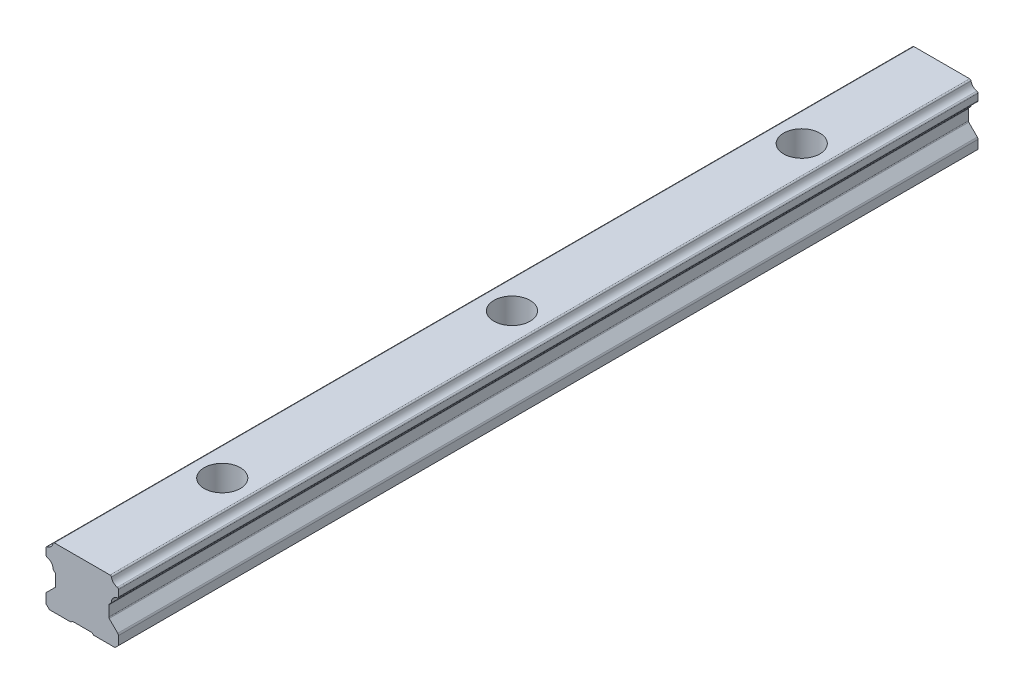
from build123d import *

# Parameters (mm, degrees)
BOSS_EXTRUDE101_DEPTH        = 178
SKETCH2_R                    = 1.5
CUT_EXTRUDE101_DEPTH         = 179.595912607
CHAMFER101_SIZE              = 0.7
FILLET101_R                  = 0.5
FILLET102_R                  = 0.3
FILLET103_R                  = 0.3
FILLET104_R                  = 0.3
CHAMFER101_OF_MIRROR101_SIZE = 0.7
FILLET101_OF_MIRROR101_R     = 0.5
FILLET102_OF_MIRROR101_R     = 0.3
FILLET103_OF_MIRROR101_R     = 0.3
FILLET104_OF_MIRROR101_R     = 0.3
CBORE101_D                   = 4.5
CBORE101_CBORE_D             = 7.5
CBORE101_CBORE_DEPTH         = 5.3
LPATTERN101_COUNT            = 3
LPATTERN101_PITCH            = 60


with BuildPart() as part:
    # Sketch1 → Boss-Extrude101 (new body)
    with BuildSketch(Plane.XY.offset(29)):
        Polygon((-2.05, 0.3), (0, 0.3), (0, 12.5), (-7.5, 12.5), (-7.5, 7.1), (-5.5, 7.1), (-5.5, 4.7), (-7.5, 2.7), (-7.5, 0), (-2.35, 0), align=None)
    boss_extrude101 = extrude(amount=-BOSS_EXTRUDE101_DEPTH)

    # Sketch2 → Cut-Extrude101 (cut, through all)
    with BuildSketch(Plane.XY.offset(29)):
        with Locations((-7.53, 12.53)):
            Circle(SKETCH2_R)
        with BuildLine():
            Line((-5.5, 7.1), (-6.030519656, 7.630519656))
            ThreePointArc((-6.030519656, 7.630519656), (-8.576608686, 8.744527923), (-7.53, 6.17))
            Line((-7.53, 6.17), (-7.5, 2.7))
            Line((-7.5, 2.7), (-5.5, 4.7))
            Line((-5.5, 4.7), (-5.5, 7.1))
        make_face()
    cut_extrude101 = extrude(amount=-CUT_EXTRUDE101_DEPTH, mode=Mode.SUBTRACT)

    # Chamfer101
    chamfer101_edges = [part.edges().sort_by_distance(p)[0] for p in [
        (-7.5, 0, -60),
    ]]
    chamfer(chamfer101_edges, length=CHAMFER101_SIZE)

    # Fillet101
    fillet101_edges = [part.edges().sort_by_distance(p)[0] for p in [
        (-7.5, 2.7, -60),
    ]]
    fillet(fillet101_edges, radius=FILLET101_R)

    # Fillet102
    fillet102_edges = [part.edges().sort_by_distance(p)[0] for p in [
        (-5.5, 7.1, -60),
    ]]
    fillet(fillet102_edges, radius=FILLET102_R)

    # Fillet103
    fillet103_edges = [part.edges().sort_by_distance(p)[0] for p in [
        (-7.5, 11.03030003, -60),
        (-6.03030003, 12.5, -60),
        (-7.5, 9.16969997, -60),
    ]]
    fillet(fillet103_edges, radius=FILLET103_R)

    # Fillet104
    fillet104_edges = [part.edges().sort_by_distance(p)[0] for p in [
        (-5.5, 4.7, -60),
    ]]
    fillet(fillet104_edges, radius=FILLET104_R)

    # Mirror101: Boss-Extrude101, Cut-Extrude101 across plane
    add(boss_extrude101.mirror(Plane(origin=(0, 0, 0), x_dir=(0, 0, 1), z_dir=(1, 0, 0))))
    add(cut_extrude101.mirror(Plane(origin=(0, 0, 0), x_dir=(0, 0, 1), z_dir=(1, 0, 0))), mode=Mode.SUBTRACT)

    # Chamfer101 of Mirror101
    chamfer101_of_mirror101_edges = [part.edges().sort_by_distance(p)[0] for p in [
        (7.5, 0, -60),
    ]]
    chamfer(chamfer101_of_mirror101_edges, length=CHAMFER101_OF_MIRROR101_SIZE)

    # Fillet101 of Mirror101
    fillet101_of_mirror101_edges = [part.edges().sort_by_distance(p)[0] for p in [
        (7.5, 2.7, -60),
    ]]
    fillet(fillet101_of_mirror101_edges, radius=FILLET101_OF_MIRROR101_R)

    # Fillet102 of Mirror101
    fillet102_of_mirror101_edges = [part.edges().sort_by_distance(p)[0] for p in [
        (5.5, 7.1, -60),
    ]]
    fillet(fillet102_of_mirror101_edges, radius=FILLET102_OF_MIRROR101_R)

    # Fillet103 of Mirror101
    fillet103_of_mirror101_edges = [part.edges().sort_by_distance(p)[0] for p in [
        (7.5, 11.03030003, -60),
        (6.03030003, 12.5, -60),
        (7.5, 9.16969997, -60),
    ]]
    fillet(fillet103_of_mirror101_edges, radius=FILLET103_OF_MIRROR101_R)

    # Fillet104 of Mirror101
    fillet104_of_mirror101_edges = [part.edges().sort_by_distance(p)[0] for p in [
        (5.5, 4.7, -60),
    ]]
    fillet(fillet104_of_mirror101_edges, radius=FILLET104_OF_MIRROR101_R)

    # CBORE101 (through all)
    with Locations(Plane(origin=(0, 12.5, 0), x_dir=(1, 0, 0), z_dir=(0, 1, 0))):
        with Locations((0, 0)):
            cbore101 = CounterBoreHole(CBORE101_D / 2, CBORE101_CBORE_D / 2, CBORE101_CBORE_DEPTH)

    # LPattern101: CBORE101 ×3
    with Locations(*[(0, 0, -i * LPATTERN101_PITCH) for i in range(1, LPATTERN101_COUNT)]):
        add(cbore101, mode=Mode.SUBTRACT)


solid = part.part
